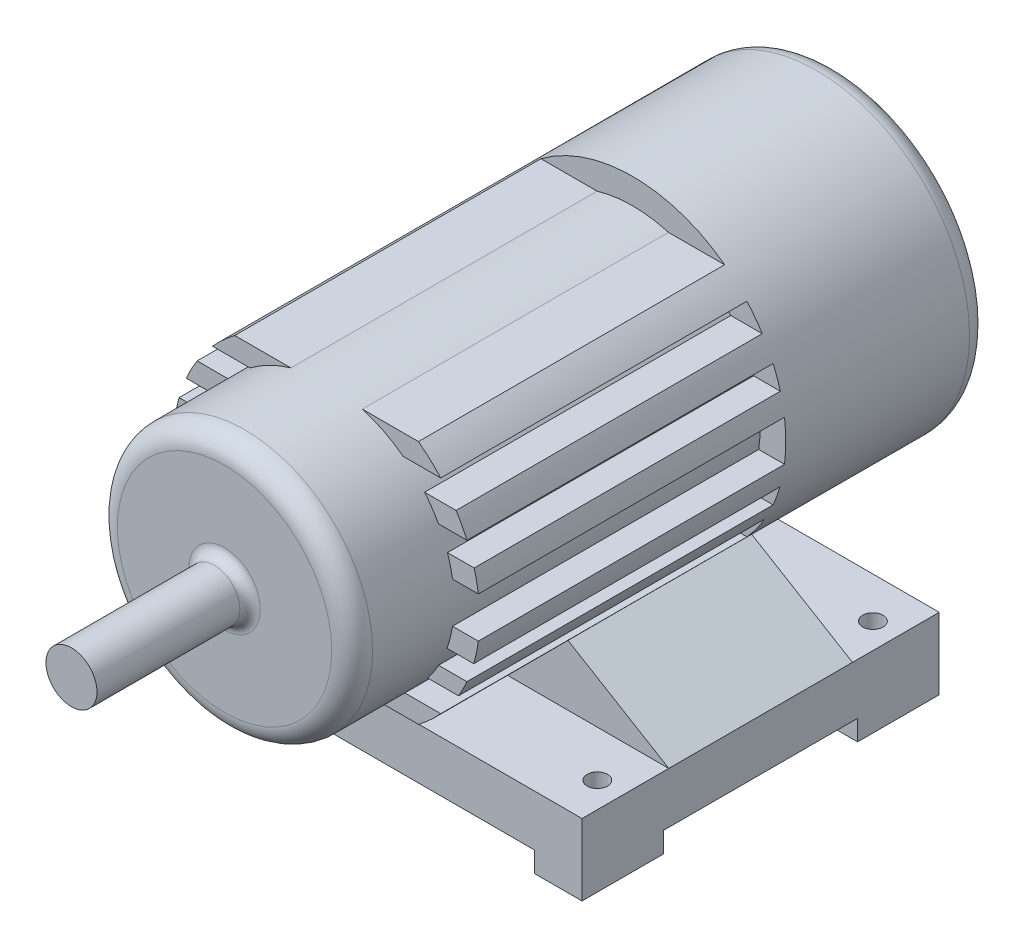
from build123d import *
from build123d.topology import SkipClean

# Parameters (mm, degrees)
SKETCH1_R            = 150
BOSS_EXTRUDE1_DEPTH  = 200
BOSS_EXTRUDE11_DEPTH = 300
BOSS_EXTRUDE14_START = -300
SKETCH12_R           = 125
BOSS_EXTRUDE14_DEPTH = 400
SKETCH13_W           = 400
SKETCH13_H           = 350
SKETCH13_R           = 10
BOSS_EXTRUDE15_DEPTH = 50
SKETCH13_3_W         = 46.677917496
SKETCH13_3_H         = 80
SKETCH13_3_R         = 10
SKETCH13_3_W_2       = 50
BOSS_EXTRUDE16_DEPTH = 20
BOSS_EXTRUDE17_DEPTH = 90
SKETCH16_R           = 25
BOSS_EXTRUDE18_DEPTH = 150
FILLET2_R            = 10
FILLET3_R            = 20


with BuildPart() as part:
    # Sketch1 → Boss-Extrude1 (new body)
    with BuildSketch(Plane.XY):
        Circle(SKETCH1_R)
    extrude(amount=BOSS_EXTRUDE1_DEPTH)

    # Sketch7 → Boss-Extrude11 (add)
    with SkipClean():  # the faces are left unmerged after this step: merging them gives an invalid solid
        with BuildSketch(Plane.XY.offset(200)):
            with BuildLine():
                Line((-90, 120), (90, 120))
                ThreePointArc((90, 120), (101.396020382, 110.538893837), (111.803398875, 100))
                Line((111.803398875, 100), (-111.803398875, 100))
                ThreePointArc((-111.803398875, 100), (-101.396020382, 110.538893837), (-90, 120))
            make_face()
            with BuildLine():
                Line((-126.885775404, 80), (126.885775404, 80))
                ThreePointArc((126.885775404, 80), (132.559251115, 70.200035213), (137.477270849, 60))
                Line((137.477270849, 60), (-137.477270849, 60))
                ThreePointArc((-137.477270849, 60), (-132.559251115, 70.200035213), (-126.885775404, 80))
            make_face()
            with BuildLine():
                Line((144.16342013, -41.435592144), (-144.16342013, -41.435592144))
                ThreePointArc((-144.16342013, -41.435592144), (-146.803816882, -30.799989431), (-148.660687473, -20))
                Line((-148.660687473, -20), (148.660687473, -20))
                ThreePointArc((148.660687473, -20), (146.803816882, -30.799989431), (144.16342013, -41.435592144))
            make_face()
            with BuildLine():
                Line((111.803398875, -100), (-111.803398875, -100))
                ThreePointArc((-111.803398875, -100), (-101.396020382, -110.538893837), (-90, -120))
                Line((-90, -120), (90, -120))
                ThreePointArc((90, -120), (101.396020382, -110.538893837), (111.803398875, -100))
            make_face()
            with BuildLine():
                Line((144.568322948, 40), (-144.568322948, 40))
                ThreePointArc((-144.568322948, 40), (-146.955139883, 30.069700063), (-148.660687473, 20))
                Line((-148.660687473, 20), (148.660687473, 20))
                ThreePointArc((148.660687473, 20), (146.955139883, 30.069700063), (144.568322948, 40))
            make_face()
            with BuildLine():
                Line((137.477270849, -60), (-137.477270849, -60))
                ThreePointArc((-137.477270849, -60), (-133.599215205, -68.20007109), (-129.232599216, -76.150740639))
                Line((-129.232599216, -76.150740639), (129.232599216, -76.150740639))
                ThreePointArc((129.232599216, -76.150740639), (133.599215205, -68.20007109), (137.477270849, -60))
            make_face()
        extrude(amount=BOSS_EXTRUDE11_DEPTH)



with BuildPart() as body_2:
    # Sketch12 → Boss-Extrude14 (new body)
    with BuildSketch(Plane.XY.offset(500).offset(BOSS_EXTRUDE14_START)):
        Circle(SKETCH12_R)
    extrude(amount=BOSS_EXTRUDE14_DEPTH)


with BuildPart() as body_3:
    # Sketch13 → Boss-Extrude15 (new body)
    with BuildSketch(Plane(origin=(0, -220, 0), x_dir=(-1, 0, 0), z_dir=(0, -1, 0))):
        with Locations((0, -274.735715433)):
            Rectangle(SKETCH13_W, SKETCH13_H)
        with Locations(Location((-175, -139.735715433, 0), (0, 0, 180))):
            Circle(SKETCH13_R, mode=Mode.SUBTRACT)
        with Locations(Location((-175, -409.735715433, 0), (0, 0, 180))):
            Circle(SKETCH13_R, mode=Mode.SUBTRACT)
        with Locations(Location((175, -409.735715433, 0), (0, 0, 180))):
            Circle(SKETCH13_R, mode=Mode.SUBTRACT)
        with Locations(Location((175, -139.735715433, 0), (0, 0, 180))):
            Circle(SKETCH13_R, mode=Mode.SUBTRACT)
    extrude(amount=-BOSS_EXTRUDE15_DEPTH)

    # Sketch13<3> → Boss-Extrude16 (add)
    # profile 1 of 4: a face of its own
    with BuildSketch(Plane(origin=(0, -220, 0), x_dir=(-1, 0, 0), z_dir=(0, -1, 0))):
        with Locations((-176.661041252, -409.735715433)):
            Rectangle(SKETCH13_3_W, SKETCH13_3_H)
        with Locations(Location((-175, -409.735715433, 0), (0, 0, 180))):
            Circle(SKETCH13_3_R, mode=Mode.SUBTRACT)
    # profile 2 of 4: a face of its own
    with BuildSketch(Plane(origin=(0, -220, 0), x_dir=(-1, 0, 0), z_dir=(0, -1, 0))):
        with Locations((-176.661041252, -139.735715433)):
            Rectangle(SKETCH13_3_W, SKETCH13_3_H)
        with Locations(Location((-175, -139.735715433, 0), (0, 0, 180))):
            Circle(SKETCH13_3_R, mode=Mode.SUBTRACT)
    # profile 3 of 4: a face of its own
    with BuildSketch(Plane(origin=(0, -220, 0), x_dir=(-1, 0, 0), z_dir=(0, -1, 0))):
        with Locations((175, -409.735715433)):
            Rectangle(SKETCH13_3_W_2, SKETCH13_3_H)
        with Locations(Location((175, -409.735715433, 0), (0, 0, 180))):
            Circle(SKETCH13_3_R, mode=Mode.SUBTRACT)
    # profile 4 of 4: a face of its own
    with BuildSketch(Plane(origin=(0, -220, 0), x_dir=(-1, 0, 0), z_dir=(0, -1, 0))):
        with Locations((175, -139.735715433)):
            Rectangle(SKETCH13_3_W_2, SKETCH13_3_H)
        with Locations(Location((175, -139.735715433, 0), (0, 0, 180))):
            Circle(SKETCH13_3_R, mode=Mode.SUBTRACT)
    extrude(amount=BOSS_EXTRUDE16_DEPTH)


with BuildPart() as part_1:
    with SkipClean():  # the faces are left unmerged after this step: merging them gives an invalid solid
        add(part.part)

        add(body_2.part)  # Boss-Extrude17 merges body 2

        add(body_3.part)  # Boss-Extrude17 merges body 3
        # Sketch14 → Boss-Extrude17 (add, symmetric)
        with BuildSketch(Plane.XY.offset(274.735715433)):
            Polygon((-200, -170), (200, -170), (100, -110), (-100, -110), align=None)
        extrude(amount=BOSS_EXTRUDE17_DEPTH, both=True)

    # Sketch16 → Boss-Extrude18 (add)
    with BuildSketch(Plane.XY.offset(600)):
        Circle(SKETCH16_R)
    extrude(amount=BOSS_EXTRUDE18_DEPTH)

    # Fillet2
    fillet2_edges = [part_1.edges().sort_by_distance(p)[0] for p in [
        (-25, 0, 600),
    ]]
    fillet(fillet2_edges, radius=FILLET2_R)

    # Fillet3
    fillet3_edges = [part_1.edges().sort_by_distance(p)[0] for p in [
        (-125, 0, 600),
        (-150, 0, 0),
    ]]
    fillet(fillet3_edges, radius=FILLET3_R)


solid = part_1.part
